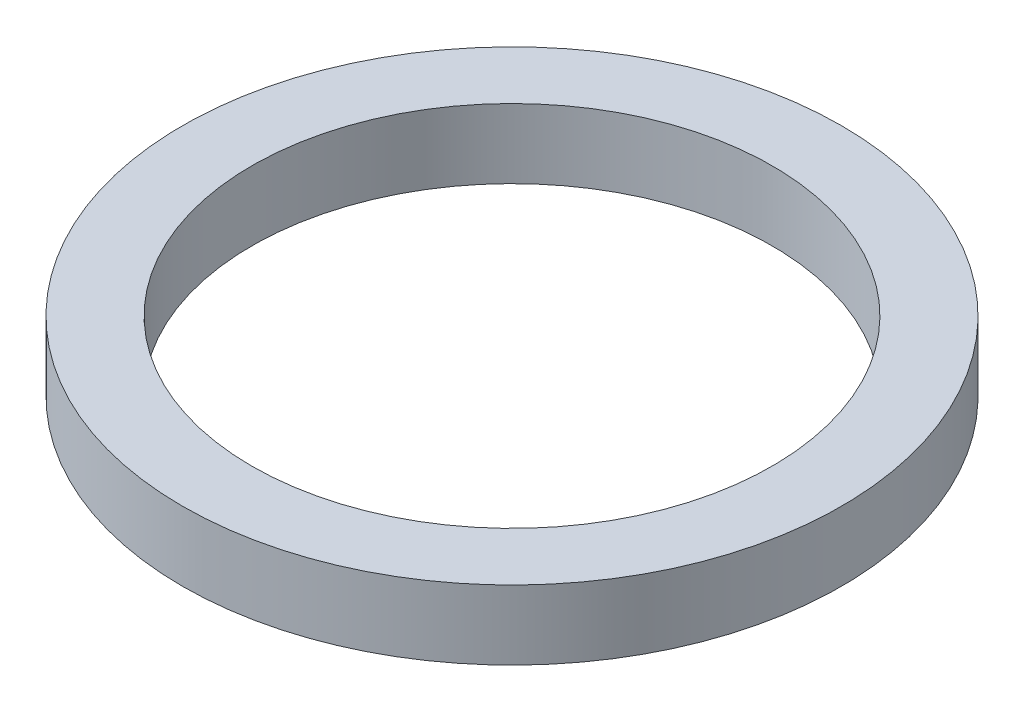
from build123d import *

# Parameters (mm, degrees)
SKETCH1_R           = 9.5
SKETCH1_R_2         = 7.5
BOSS_EXTRUDE1_DEPTH = 2


with BuildPart() as part:
    # Sketch1 → Boss-Extrude1 (new body)
    with BuildSketch(Plane(origin=(0, 0, 0), x_dir=(1, 0, 0), z_dir=(0, 1, 0))):
        with Locations(Location((0, 0, 0), (0, 0, 270))):
            Circle(SKETCH1_R)
        with Locations(Location((0, 0, 0), (0, 0, 270))):
            Circle(SKETCH1_R_2, mode=Mode.SUBTRACT)
    extrude(amount=BOSS_EXTRUDE1_DEPTH)


solid = part.part
